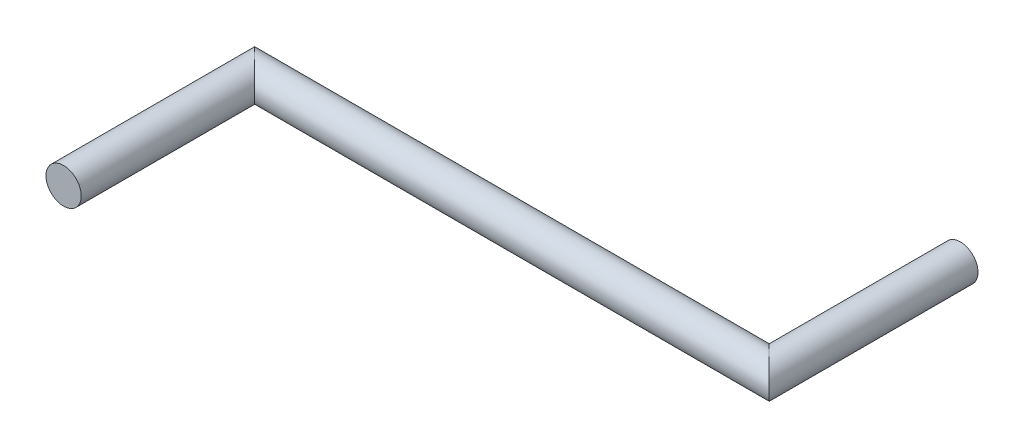
from build123d import *

# Parameters (mm, degrees)
SKETCH2_R = 0.6


with BuildPart() as part:
    # Sweep1: sweep along a path in Sketch1
    with BuildLine(Plane(origin=(0, 0, 0), x_dir=(1, 0, 0), z_dir=(0, 1, 0))) as sweep1_path:
        Line((8.75, 6.5), (8.75, 0))
        Line((8.75, 0), (-8.75, 0))
        Line((-8.75, 0), (-8.75, -6.5))
    # Sketch2 → Sweep1 (sweep)
    with BuildSketch(Plane(origin=(-8.75, 0, 6.5), x_dir=(1, 0, 0), z_dir=(0, 0, 1))):
        Circle(SKETCH2_R)
    sweep(path=sweep1_path.line, transition=Transition.RIGHT)


solid = part.part
